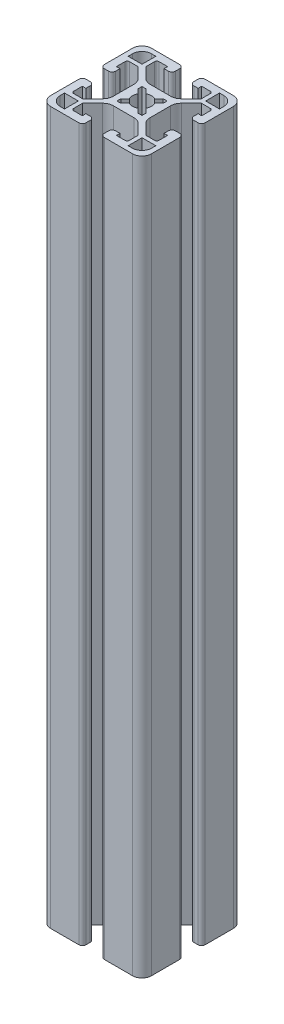
from build123d import *

# Parameters (mm, degrees)
SKETCH1_W           = 4.9403
SKETCH1_H           = 4.9403
BOSS_EXTRUDE6_DEPTH = 254
FILLET1_R           = 3.4125154
FILLET2_R           = 0.762
FILLET3_R           = 1.27
FILLET4_R           = 3.81


with BuildPart() as part:
    # Sketch1 → Boss-Extrude6 (new body)
    with BuildSketch(Plane(origin=(0, 0, 0), x_dir=(1, 0, 0), z_dir=(0, 1, 0))):
        Polygon((-7.366, -7.366), (7.366, -7.366), (7.366, -3.302), (4.510882512, -3.302), (4.572, -4.572), (0.7239, -4.572), (0.7239, -0.64109893), (5.404132197, 4.039133267), (15.856734336, 4.039133267), (20.536966533, -0.64109893), (20.536966533, -4.572), (16.688866533, -4.572), (16.749984021, -3.302), (13.894866533, -3.302), (13.894866533, -7.366), (28.626866533, -7.366), (28.626866533, 7.366), (24.562866533, 7.366), (24.562866533, 4.510882512), (25.832866533, 4.572), (25.832866533, 0.7239), (21.901965464, 0.7239), (17.221733267, 5.404132197), (17.221733267, 15.856734336), (21.901965464, 20.536966533), (25.832866533, 20.536966533), (25.832866533, 16.688866533), (24.562866533, 16.749984021), (24.562866533, 13.894866533), (28.626866533, 13.894866533), (28.626866533, 28.626866533), (13.894866533, 28.626866533), (13.894866533, 24.562866533), (16.749984021, 24.562866533), (16.688866533, 25.832866533), (20.536966533, 25.832866533), (20.536966533, 21.901965464), (15.856734336, 17.221733267), (5.404132197, 17.221733267), (0.7239, 21.901965464), (0.7239, 25.832866533), (4.572, 25.832866533), (4.510882512, 24.562866533), (7.366, 24.562866533), (7.366, 28.626866533), (-7.366, 28.626866533), (-7.366, 13.894866533), (-3.302, 13.894866533), (-3.302, 16.749984021), (-4.572, 16.688866533), (-4.572, 20.536966533), (-0.64109893, 20.536966533), (4.039133267, 15.856734336), (4.039133267, 5.404132197), (-0.64109893, 0.7239), (-4.572, 0.7239), (-4.572, 4.572), (-3.302, 4.510882512), (-3.302, 7.366), (-7.366, 7.366), align=None)
        with Locations((-3.19405, -3.19405)):
            Rectangle(SKETCH1_W, SKETCH1_H, mode=Mode.SUBTRACT)
        with Locations((-3.19405, 24.454916533)):
            Rectangle(SKETCH1_W, SKETCH1_H, mode=Mode.SUBTRACT)
        with Locations((24.454916533, 24.454916533)):
            Rectangle(SKETCH1_W, SKETCH1_H, mode=Mode.SUBTRACT)
        with Locations((24.454916533, -3.19405)):
            Rectangle(SKETCH1_W, SKETCH1_H, mode=Mode.SUBTRACT)
        with BuildLine():
            Line((7.696270003, 12.1995976), (6.157493267, 13.738374336))
            Line((6.157493267, 13.738374336), (6.157493267, 15.103373267))
            Line((6.157493267, 15.103373267), (7.522492197, 15.103373267))
            Line((7.522492197, 15.103373267), (9.061268934, 13.56459653))
            ThreePointArc((9.061268934, 13.56459653), (10.630433267, 13.957833267), (12.1995976, 13.56459653))
            Line((12.1995976, 13.56459653), (13.738374336, 15.103373267))
            Line((13.738374336, 15.103373267), (15.103373267, 15.103373267))
            Line((15.103373267, 15.103373267), (15.103373267, 13.738374336))
            Line((15.103373267, 13.738374336), (13.56459653, 12.1995976))
            ThreePointArc((13.56459653, 12.1995976), (13.957833267, 10.630433267), (13.56459653, 9.061268934))
            Line((13.56459653, 9.061268934), (15.103373267, 7.522492197))
            Line((15.103373267, 7.522492197), (15.103373267, 6.157493267))
            Line((15.103373267, 6.157493267), (13.738374336, 6.157493267))
            Line((13.738374336, 6.157493267), (12.1995976, 7.696270003))
            ThreePointArc((12.1995976, 7.696270003), (10.630433267, 7.303033267), (9.061268934, 7.696270003))
            Line((9.061268934, 7.696270003), (7.522492197, 6.157493267))
            Line((7.522492197, 6.157493267), (6.157493267, 6.157493267))
            Line((6.157493267, 6.157493267), (6.157493267, 7.522492197))
            Line((6.157493267, 7.522492197), (7.696270003, 9.061268934))
            ThreePointArc((7.696270003, 9.061268934), (7.303033267, 10.630433267), (7.696270003, 12.1995976))
        make_face(mode=Mode.SUBTRACT)
    extrude(amount=BOSS_EXTRUDE6_DEPTH)

    # Fillet1
    fillet1_edges = [part.edges().sort_by_distance(p)[0] for p in [
        (-7.366, 127, 7.366),
        (-7.366, 127, -28.626866533),
        (28.626866533, 127, -28.626866533),
        (28.626866533, 127, 7.366),
        (26.925066533, 127, 5.6642),
        (26.925066533, 127, -26.925066533),
        (-5.6642, 127, -26.925066533),
        (-5.6642, 127, 5.6642),
    ]]
    fillet(fillet1_edges, radius=FILLET1_R)

    # Fillet2
    fillet2_edges = [part.edges().sort_by_distance(p)[0] for p in [
        (0.7239, 127, 4.572),
        (-4.572, 127, -0.7239),
        (-4.572, 127, -20.536966533),
        (0.7239, 127, -25.832866533),
        (20.536966533, 127, -25.832866533),
        (25.832866533, 127, -20.536966533),
        (25.832866533, 127, -0.7239),
        (20.536966533, 127, 4.572),
    ]]
    fillet(fillet2_edges, radius=FILLET2_R)

    # Fillet3
    fillet3_edges = [part.edges().sort_by_distance(p)[0] for p in [
        (7.366, 127, 3.302),
        (7.366, 127, 7.366),
        (-7.366, 127, -7.366),
        (-3.302, 127, -7.366),
        (-3.302, 127, -13.894866533),
        (-7.366, 127, -13.894866533),
        (7.366, 127, -28.626866533),
        (7.366, 127, -24.562866533),
        (13.894866533, 127, -24.562866533),
        (13.894866533, 127, -28.626866533),
        (28.626866533, 127, -13.894866533),
        (24.562866533, 127, -13.894866533),
        (24.562866533, 127, -7.366),
        (28.626866533, 127, -7.366),
        (13.894866533, 127, 7.366),
        (13.894866533, 127, 3.302),
    ]]
    fillet(fillet3_edges, radius=FILLET3_R)

    # Fillet4
    fillet4_edges = [part.edges().sort_by_distance(p)[0] for p in [
        (4.039133267, 127, -5.404132197),
        (4.039133267, 127, -15.856734336),
        (5.404132197, 127, -17.221733267),
        (15.856734336, 127, -17.221733267),
        (17.221733267, 127, -15.856734336),
        (17.221733267, 127, -5.404132197),
        (15.856734336, 127, -4.039133267),
        (5.404132197, 127, -4.039133267),
    ]]
    fillet(fillet4_edges, radius=FILLET4_R)


solid = part.part
